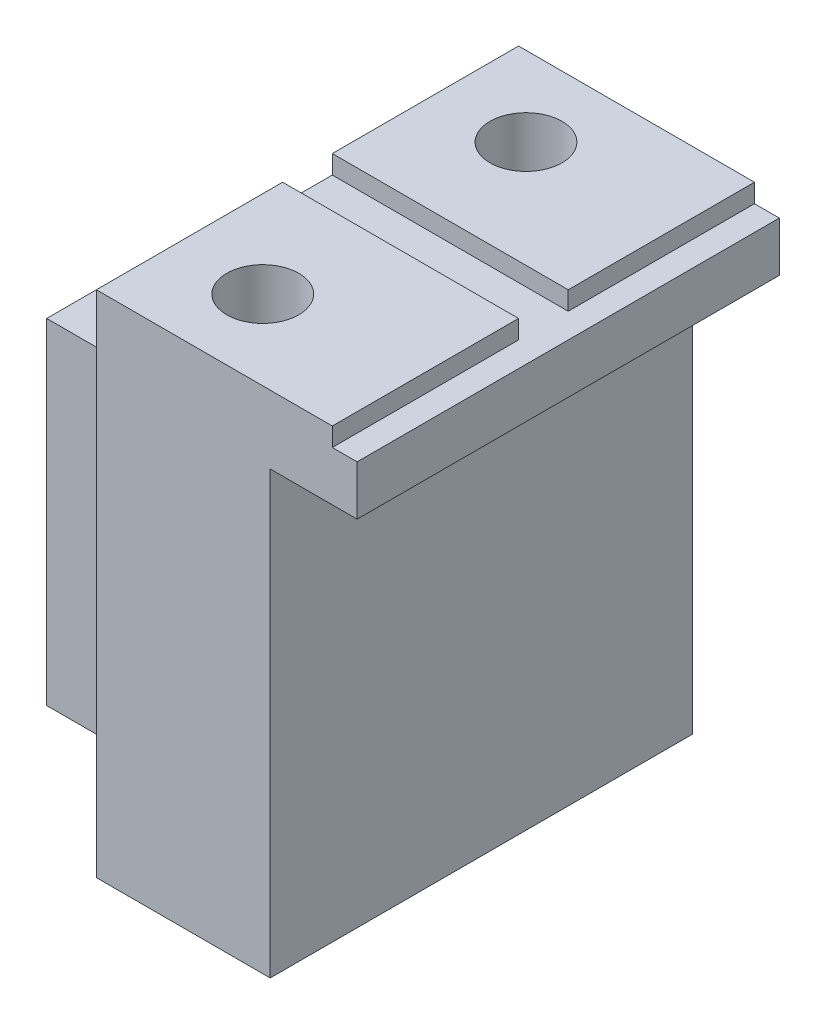
from build123d import *

# Parameters (mm, degrees)
SALIENTE_EXTRUIR1_DEPTH      = 7
CROQUIS5_R                   = 1.6
CORTAR_EXTRUIR2_DEPTH        = 13.9
CROQUIS6_R                   = 2.75
CORTAR_EXTRUIR3_DEPTH        = 3
SALIENTE_EXTRUIR2_DEPTH      = 5
SALIENTE_EXTRUIR2_DEPTH_BACK = 12
CROQUIS8_R                   = 1.45
CORTAR_EXTRUIR4_DEPTH        = 10
CROQUIS9_W                   = 2
CROQUIS9_H                   = 0.75
CORTAR_EXTRUIR5_DEPTH        = 10
CROQUIS10_R                  = 1.6
SALIENTE_EXTRUIR3_DEPTH      = 4


with BuildPart() as part:
    # Croquis1 → Saliente-Extruir1 (new body)
    with BuildSketch(Plane.XY):
        Polygon((0, 0), (4, 0), (4, -4), (7, -4), (7, 0), (7, 13.75), (10.5, 13.75), (10.5, 15.75), (9.5, 15.75), (9.5, 16.5), (7, 16.5), (0, 16.5), (0, 9.5), (-7, 9.5), (-7, 0), align=None)
    extrude(amount=SALIENTE_EXTRUIR1_DEPTH)

    # Croquis5 → Cortar-Extruir2 (cut)
    with BuildSketch(Plane(origin=(0, 9.5, 0), x_dir=(1, 0, 0), z_dir=(0, 1, 0))):
        with Locations(Location((-3.5, -3.5, 0), (0, 0, 180))):
            Circle(CROQUIS5_R)
    extrude(amount=-CORTAR_EXTRUIR2_DEPTH, mode=Mode.SUBTRACT)

    # Croquis6 → Cortar-Extruir3 (cut)
    with BuildSketch(Plane(origin=(0, 9.5, 0), x_dir=(1, 0, 0), z_dir=(0, 1, 0))):
        with Locations(Location((-3.5, -3.5, 0), (0, 0, 180))):
            Circle(CROQUIS6_R)
    extrude(amount=-CORTAR_EXTRUIR3_DEPTH, mode=Mode.SUBTRACT)

    # Croquis7 → Saliente-Extruir2 (add, two sides: drawn at the far end of the back side and taken through both)
    with BuildSketch(Plane.XY.offset(7).offset(-SALIENTE_EXTRUIR2_DEPTH_BACK)):
        Polygon((0, 16.5), (0, 0), (7, 0), (7, 13.75), (10.5, 13.75), (10.5, 15.75), (9.5, 15.75), (9.5, 16.5), align=None)
    extrude(amount=SALIENTE_EXTRUIR2_DEPTH + SALIENTE_EXTRUIR2_DEPTH_BACK)

    # Croquis8 → Cortar-Extruir4 (cut)
    with BuildSketch(Plane(origin=(0, 16.5, 0), x_dir=(1, 0, 0), z_dir=(0, 1, 0))):
        with Locations(Location((3.5, 1.8, 0), (0, 0, 270))):
            Circle(CROQUIS8_R)
        with Locations(Location((3.5, -8.8, 0), (0, 0, 90))):
            Circle(CROQUIS8_R)
    extrude(amount=-CORTAR_EXTRUIR4_DEPTH, mode=Mode.SUBTRACT)

    # Croquis9 → Cortar-Extruir5 (cut)
    with BuildSketch(Plane(origin=(9.5, 0, 0), x_dir=(0, 0, -1), z_dir=(1, 0, 0))):
        with Locations((-3.5, 16.125)):
            Rectangle(CROQUIS9_W, CROQUIS9_H)
    extrude(amount=-CORTAR_EXTRUIR5_DEPTH, mode=Mode.SUBTRACT)

    # Croquis10 → Saliente-Extruir3 (add)
    with BuildSketch(Plane.XZ):
        Polygon((-7, 0), (0, 0), (0, -5), (7, -5), (7, 0), (4, 0), (4, 7), (7, 7), (7, 12), (0, 12), (0, 7), (-7, 7), align=None)
        with Locations(Location((-3.5, 3.5, 0), (0, 0, 180))):
            Circle(CROQUIS10_R, mode=Mode.SUBTRACT)
    extrude(amount=SALIENTE_EXTRUIR3_DEPTH)


solid = part.part
